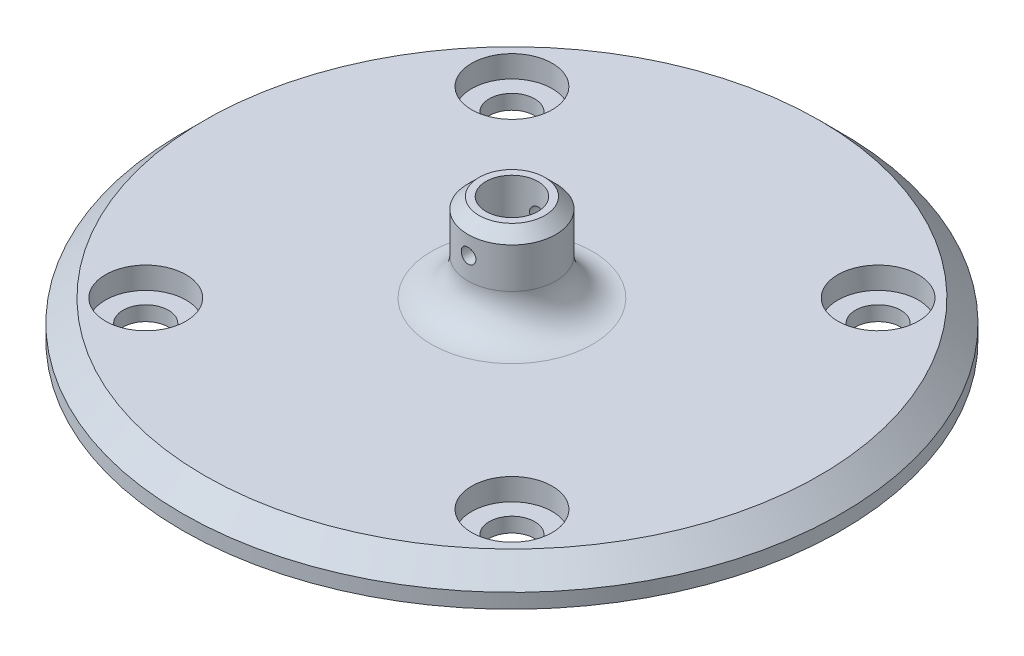
from build123d import *

# Parameters (mm, degrees)
SKETCH1_R               = 45
BOSS_EXTRUDE1_DEPTH     = 5
SKETCH2_R               = 3.1
CUT_EXTRUDE1_DEPTH      = 64.835726674
SKETCH8_R               = 5.5
CUT_EXTRUDE6_DEPTH      = 3
CIRPATTERN1_COUNT       = 4
SKETCH3_R               = 6
BOSS_EXTRUDE2_DEPTH     = 12
SKETCH4_R               = 3.55
CUT_EXTRUDE2_DEPTH      = 14
SKETCH5_R               = 3.05
CUT_EXTRUDE3_DEPTH      = 66.161338231
FILLET1_R               = 5
CUT_EXTRUDE5_DEPTH      = 66.871086221
CUT_EXTRUDE5_DEPTH_BACK = 66.871086221
SKETCH7_R               = 1
CHAMFER1_SIZE           = 3
CHAMFER2_SIZE           = 1.5


with BuildPart() as part:
    # Sketch1 → Boss-Extrude1 (new body)
    with BuildSketch(Plane(origin=(0, 0, 0), x_dir=(1, 0, 0), z_dir=(0, 1, 0))):
        with Locations(Location((0, 0, 0), (0, 0, 270))):
            Circle(SKETCH1_R)
    extrude(amount=BOSS_EXTRUDE1_DEPTH)

    # Sketch2 → Cut-Extrude1 (cut, through all)
    with BuildSketch(Plane(origin=(0, 5, 0), x_dir=(1, 0, 0), z_dir=(0, 1, 0))):
        with Locations(Location((-25, 25, 0), (0, 0, 270))):
            Circle(SKETCH2_R)
    cut_extrude1 = extrude(amount=-CUT_EXTRUDE1_DEPTH, mode=Mode.SUBTRACT)

    # Sketch8 → Cut-Extrude6 (cut)
    with BuildSketch(Plane(origin=(0, 5, 0), x_dir=(1, 0, 0), z_dir=(0, 1, 0))):
        with Locations(Location((-25, 25, 0), (0, 0, 270))):
            Circle(SKETCH8_R)
    cut_extrude6 = extrude(amount=-CUT_EXTRUDE6_DEPTH, mode=Mode.SUBTRACT)

    # CirPattern1: Cut-Extrude1, Cut-Extrude6 ×4 about axis
    cirpattern1_axis = Axis((0, 0, 0), (0, 1, 0))
    add([cut_extrude1.rotate(cirpattern1_axis, i * 360 / CIRPATTERN1_COUNT) for i in range(1, CIRPATTERN1_COUNT)], mode=Mode.SUBTRACT)
    add([cut_extrude6.rotate(cirpattern1_axis, i * 360 / CIRPATTERN1_COUNT) for i in range(1, CIRPATTERN1_COUNT)], mode=Mode.SUBTRACT)

    # Sketch3 → Boss-Extrude2 (add)
    with BuildSketch(Plane(origin=(0, 5, 0), x_dir=(1, 0, 0), z_dir=(0, 1, 0))):
        with Locations(Location((0, 0, 0), (0, 0, 270))):
            Circle(SKETCH3_R)
    extrude(amount=BOSS_EXTRUDE2_DEPTH)

    # Sketch4 → Cut-Extrude2 (cut)
    with BuildSketch(Plane(origin=(0, 17, 0), x_dir=(1, 0, 0), z_dir=(0, 1, 0))):
        with Locations(Location((0, 0, 0), (0, 0, 270))):
            Circle(SKETCH4_R)
    extrude(amount=-CUT_EXTRUDE2_DEPTH, mode=Mode.SUBTRACT)

    # Sketch5 → Cut-Extrude3 (cut, through all)
    with BuildSketch(Plane(origin=(0, 3, 0), x_dir=(1, 0, 0), z_dir=(0, 1, 0))):
        with Locations(Location((0, 0, 0), (0, 0, 270))):
            Circle(SKETCH5_R)
    extrude(amount=-CUT_EXTRUDE3_DEPTH, mode=Mode.SUBTRACT)

    # Fillet1
    fillet1_edges = [part.edges().sort_by_distance(p)[0] for p in [
        (0, 5, -6),
    ]]
    fillet(fillet1_edges, radius=FILLET1_R)

    # Sketch7 → Cut-Extrude5 (cut, two sides: drawn at the far end of the back side and taken through both)
    with BuildSketch(Plane(origin=(0, 0, 0), x_dir=(-1, 0, 0), z_dir=(0, 0, -1)).offset(-CUT_EXTRUDE5_DEPTH_BACK)):
        with Locations((0, 13)):
            Circle(SKETCH7_R)
    extrude(amount=CUT_EXTRUDE5_DEPTH + CUT_EXTRUDE5_DEPTH_BACK, mode=Mode.SUBTRACT)

    # Chamfer1
    chamfer1_edges = [part.edges().sort_by_distance(p)[0] for p in [
        (0, 5, -45),
    ]]
    chamfer(chamfer1_edges, length=CHAMFER1_SIZE)

    # Chamfer2
    chamfer2_edges = [part.edges().sort_by_distance(p)[0] for p in [
        (0, 17, -6),
    ]]
    chamfer(chamfer2_edges, length=CHAMFER2_SIZE)


solid = part.part
